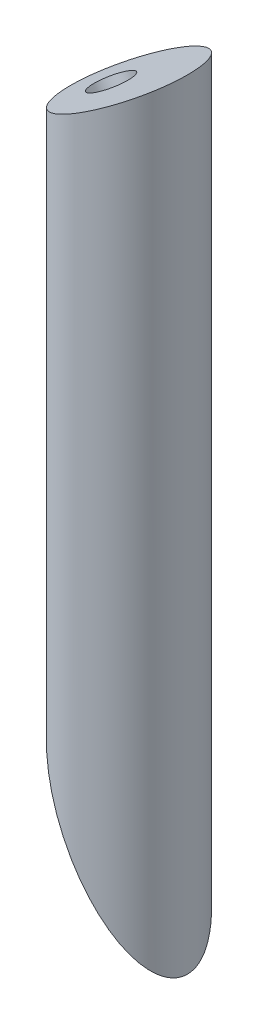
from build123d import *

# Parameters (mm, degrees)
SKETCH2_R           = 7.5
BOSS_EXTRUDE1_DEPTH = 100
CUT_EXTRUDE1_DEPTH  = 50
SKETCH4_R           = 2.5
CUT_EXTRUDE2_DEPTH  = 10
SKETCH5_R           = 2.5
CUT_EXTRUDE3_DEPTH  = 7


with BuildPart() as part:
    # Sketch2 → Boss-Extrude1 (new body)
    with BuildSketch(Plane(origin=(0, 0, 0), x_dir=(1, 0, 0), z_dir=(0, 1, 0))):
        with Locations(Location((0, 0, 0), (0, 0, 270))):
            Circle(SKETCH2_R)
    extrude(amount=BOSS_EXTRUDE1_DEPTH)

    # Sketch3 → Cut-Extrude1 (cut, symmetric)
    with BuildSketch(Plane.XY):
        Polygon((7.5, 0), (7.5, -12.76822714), (-21.221619576, -12.76822714), (-21.221619576, 49.747304381), align=None)
        Polygon((7.5, 100), (-17.243882573, 85.714112735), (-17.243882573, 115.180651771), (7.5, 115.180651771), align=None)
    extrude(amount=CUT_EXTRUDE1_DEPTH, both=True, mode=Mode.SUBTRACT)

    # Sketch4 → Cut-Extrude2 (cut)
    with BuildSketch(Plane(origin=(-41.426270189, 71.752404736, 0), x_dir=(0.8660254037844379, 0.5000000000000013, 0), z_dir=(-0.5000000000000013, 0.8660254037844379, 0))):
        with Locations(Location((45.174682453, 0, 0), (0, 0, 180))):
            Circle(SKETCH4_R)
    extrude(amount=-CUT_EXTRUDE2_DEPTH, mode=Mode.SUBTRACT)

    # Sketch5 → Cut-Extrude3 (cut)
    with BuildSketch(Plane(origin=(5.625, 3.247595264, 0), x_dir=(0, 0, 1), z_dir=(-0.8660254037844397, -0.4999999999999981, 0))):
        with Locations(Location((0, 18.25, 0), (0, 0, 270))):
            Circle(SKETCH5_R)
    extrude(amount=-CUT_EXTRUDE3_DEPTH, mode=Mode.SUBTRACT)


solid = part.part
